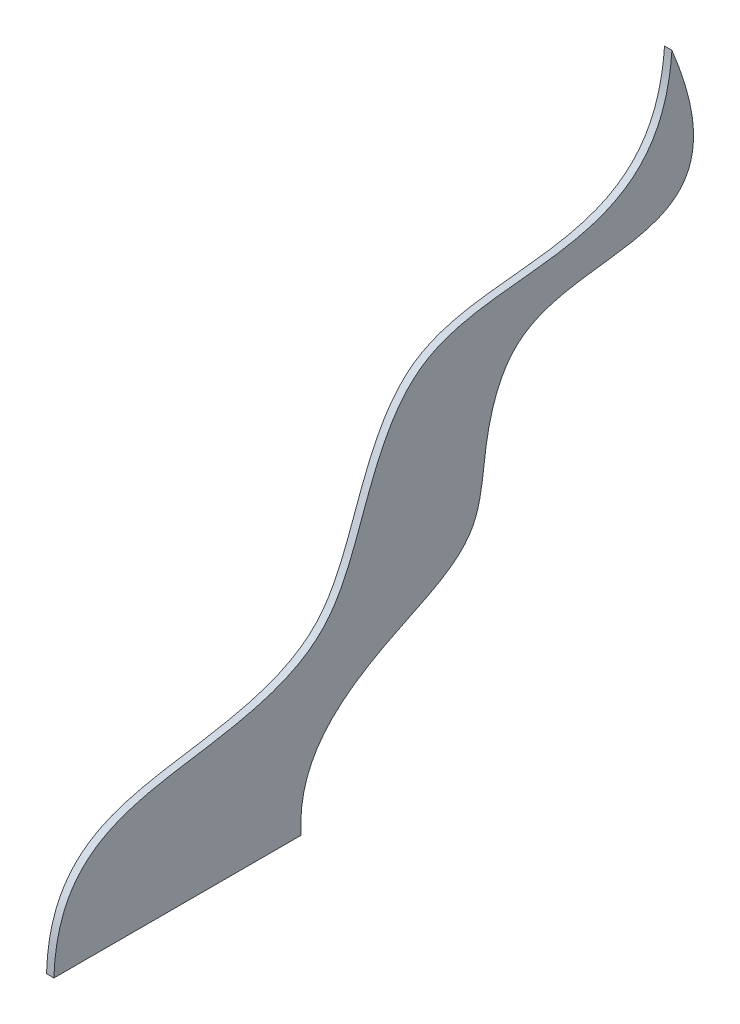
from build123d import *

# Parameters (mm, degrees)
BOSS_EXTRUDE1_DEPTH = 3


with BuildPart() as part:
    # Sketch2 → Boss-Extrude1 (new body)
    with BuildSketch(Plane(origin=(0, 0, 0), x_dir=(0, 0, -1), z_dir=(1, 0, 0))):
        with BuildLine():
            Line((0, 0), (100, 0))
            add(Edge.make_bspline(
                [(100, 0), (98.114779477, 27.943745364), (126.668766505, 48.258870479), (173.094046969, 67.011449525), (173.489851015, 101.064750008), (193.334055137, 160.453215445), (283.199348363, 119.321534616), (250, 200)],
                knots=[0, 0, 0, 0, 0.251771735, 0.382046107, 0.484861399, 0.597251359, 1, 1, 1, 1], degree=3))
            add(Edge.make_bspline(
                [(0, 0), (1.296631031, 42.867181234), (48.395819211, 46.026360786), (110.868590671, 59.568359073), (125.72993736, 102.902711958), (152.878485336, 172.252993095), (245.40143086, 132.791021891), (250, 200)],
                knots=[0, 0, 0, 0, 0.258213757, 0.403782189, 0.51003565, 0.643754128, 1, 1, 1, 1], degree=3))
        make_face()
    extrude(amount=BOSS_EXTRUDE1_DEPTH)


solid = part.part
